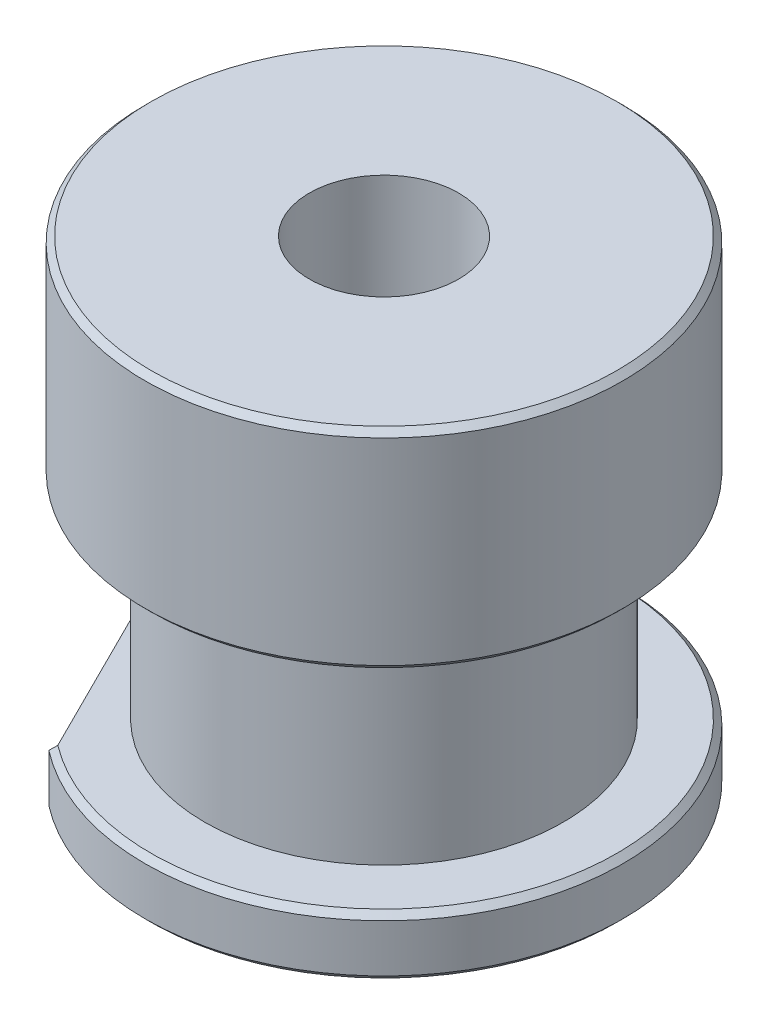
from build123d import *

# Parameters (mm, degrees)
SKETCH1_R             = 8
BOSS_EXTRUDE1_DEPTH   = 7
SKETCH2_R             = 6
BOSS_EXTRUDE2_DEPTH   = 7
SKETCH3_R             = 8
BOSS_EXTRUDE3_DEPTH   = 2
CHAMFER1_SIZE         = 0.2
SKETCH4_R             = 2.5
CUT_EXTRUDE1_DEPTH    = 20
BODY_MOVE_COPY1_ANGLE = 180
CUT_EXTRUDE2_DEPTH    = 3


with BuildPart() as part:
    # Sketch1 → Boss-Extrude1 (new body)
    with BuildSketch(Plane(origin=(0, 0, 0), x_dir=(1, 0, 0), z_dir=(0, 1, 0))):
        with Locations(Location((0, 0, 0), (0, 0, 270))):
            Circle(SKETCH1_R)
    extrude(amount=BOSS_EXTRUDE1_DEPTH)

    # Sketch2 → Boss-Extrude2 (add)
    with BuildSketch(Plane(origin=(0, 7, 0), x_dir=(1, 0, 0), z_dir=(0, 1, 0))):
        with Locations(Location((0, 0, 0), (0, 0, 270))):
            Circle(SKETCH2_R)
    extrude(amount=BOSS_EXTRUDE2_DEPTH)

    # Sketch3 → Boss-Extrude3 (add)
    with BuildSketch(Plane(origin=(0, 14, 0), x_dir=(1, 0, 0), z_dir=(0, 1, 0))):
        with Locations(Location((0, 0, 0), (0, 0, 270))):
            Circle(SKETCH3_R)
    extrude(amount=BOSS_EXTRUDE3_DEPTH)

    # Chamfer1
    chamfer1_edges = [part.edges().sort_by_distance(p)[0] for p in [
        (0, 0, -8),
        (0, 7, -8),
        (0, 14, -8),
        (0, 16, -8),
    ]]
    chamfer(chamfer1_edges, length=CHAMFER1_SIZE)

    # Sketch4 → Cut-Extrude1 (cut)
    with BuildSketch(Plane(origin=(0, 16, 0), x_dir=(1, 0, 0), z_dir=(0, 1, 0))):
        with Locations(Location((0, 0, 0), (0, 0, 270))):
            Circle(SKETCH4_R)
    extrude(amount=-CUT_EXTRUDE1_DEPTH, mode=Mode.SUBTRACT)


with BuildPart() as part_1:
    # Body-Move/Copy1: moved
    add(part.part.moved(Location((0, 0, 0))).rotate(Axis((0, 8, 0), (1, 0, 0)), BODY_MOVE_COPY1_ANGLE))

    # Sketch5 → Cut-Extrude2 (cut)
    with BuildSketch(Plane.XZ):
        with BuildLine():
            Line((-4.692804326, 6.230376197), (-7.8, 0))
            ThreePointArc((-7.8, 0), (-9.361590262, 4.668785935), (-4.692804326, 6.230376197))
        make_face()
    extrude(amount=-CUT_EXTRUDE2_DEPTH, mode=Mode.SUBTRACT)


solid = part_1.part
